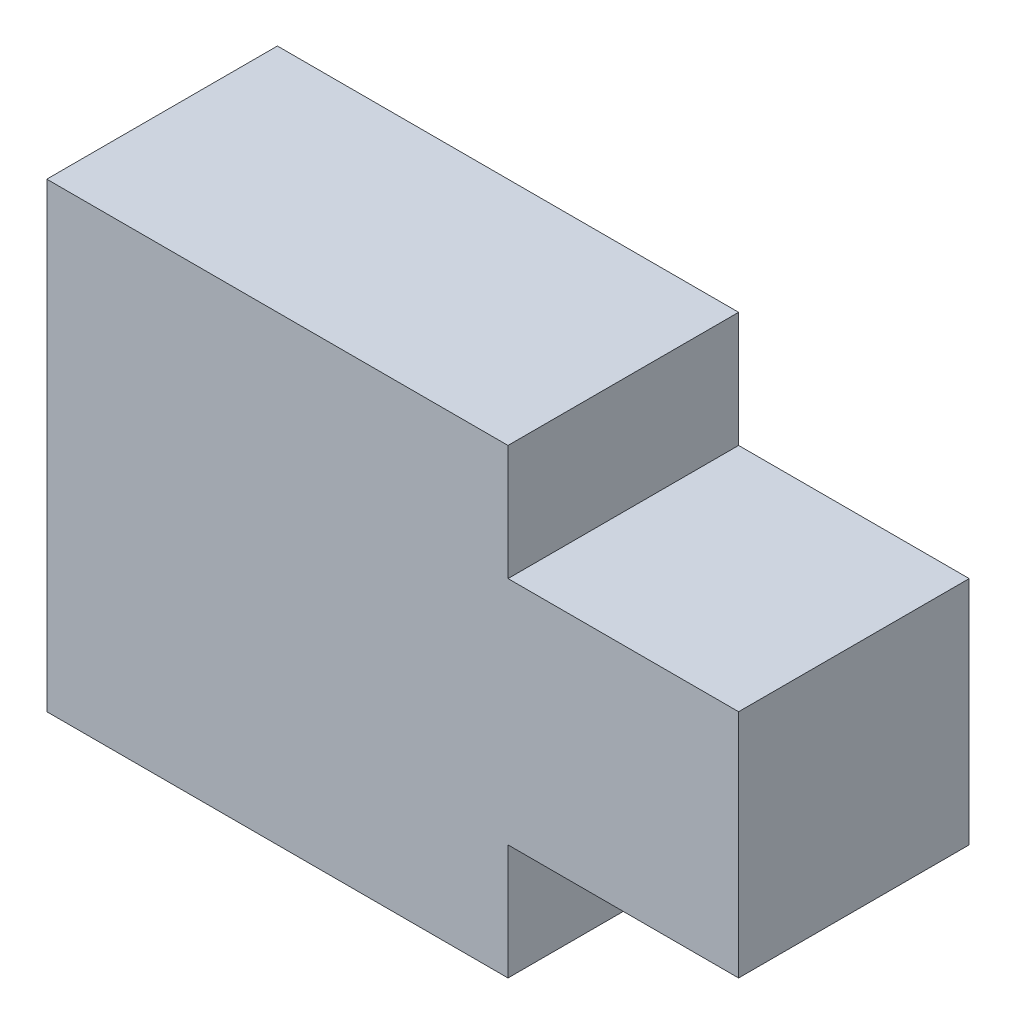
from build123d import *

# Parameters (mm, degrees)
SCHIZZO1_W                   = 50
SCHIZZO1_H                   = 50
ESTRUSIONE_ESTRUSIONE1_DEPTH = 50


with BuildPart() as part:
    # Schizzo1 → Estrusione-Estrusione1 (new body)
    with BuildSketch(Plane.XY):
        with Locations((25, 75)):
            Rectangle(SCHIZZO1_W, SCHIZZO1_H)
        with Locations((25, 25)):
            Rectangle(SCHIZZO1_W, SCHIZZO1_H)
        Polygon((50, 50), (50, 0), (100, 0), (100, 25), (100, 50), align=None)
        Polygon((50, 100), (50, 50), (100, 50), (100, 75), (100, 100), align=None)
        with Locations((125, 50)):
            Rectangle(SCHIZZO1_W, SCHIZZO1_H)
    extrude(amount=ESTRUSIONE_ESTRUSIONE1_DEPTH)


solid = part.part
